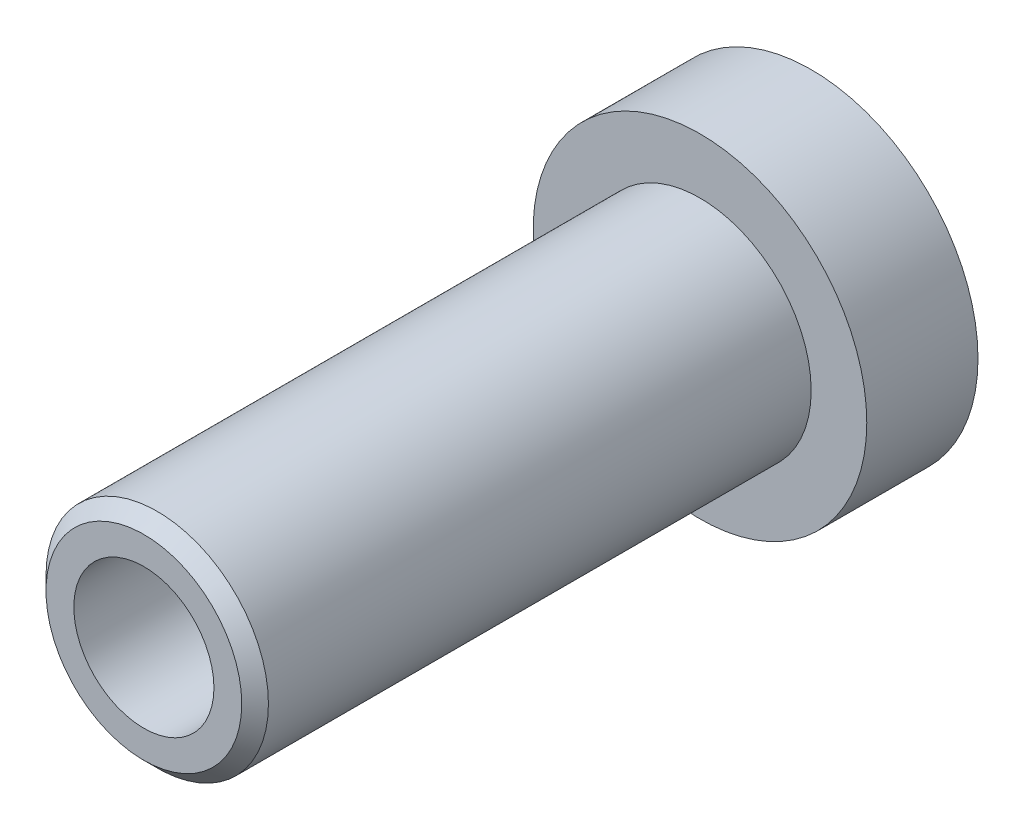
from build123d import *

# Parameters (mm, degrees)
SKETCH1_R           = 0.75
BOSS_EXTRUDE1_DEPTH = 0.5
SKETCH2_R           = 0.5
BOSS_EXTRUDE2_DEPTH = 2.5
SKETCH3_R           = 0.315
CUT_EXTRUDE1_DEPTH  = 3


with BuildPart() as part:
    # Sketch1 → Boss-Extrude1 (new body)
    with BuildSketch(Plane.XY):
        Circle(SKETCH1_R)
    extrude(amount=BOSS_EXTRUDE1_DEPTH)

    # Sketch2 → Boss-Extrude2 (add)
    with BuildSketch(Plane.XY.offset(0.5)):
        Circle(SKETCH2_R)
    extrude(amount=BOSS_EXTRUDE2_DEPTH)

    # Sketch3 → Cut-Extrude1 (cut)
    with BuildSketch(Plane.XY.offset(3)):
        Circle(SKETCH3_R)
    extrude(amount=-CUT_EXTRUDE1_DEPTH, mode=Mode.SUBTRACT)

    # Sketch5 → Cut-Revolve1 (revolve, cut)
    with BuildSketch(Plane(origin=(0, 0, 0), x_dir=(0, 0, -1), z_dir=(1, 0, 0)), mode=Mode.PRIVATE) as cut_revolve1_sk:
        Polygon((-3, 0.5), (-2.94, 0.5), (-3, 0.44), align=None)
    revolve(cut_revolve1_sk.sketch.rotate(Axis((0, 0, 3), (0, 0, -1)), 90), axis=Axis((0, 0, 3), (0, 0, -1)), mode=Mode.SUBTRACT)


solid = part.part
